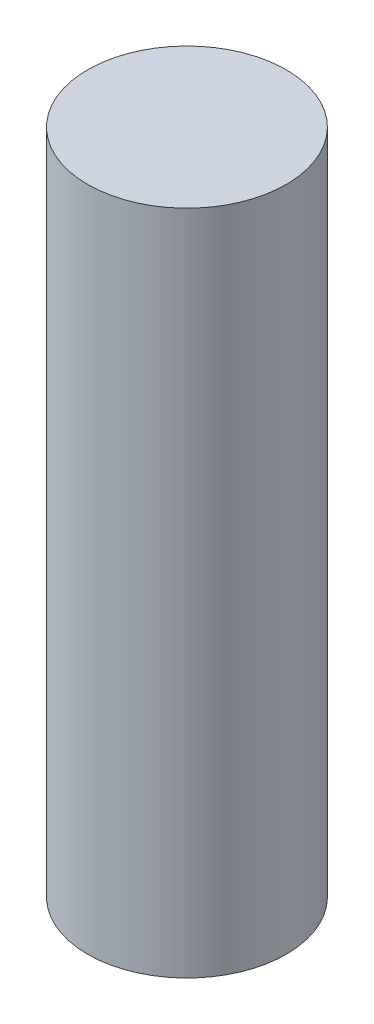
from build123d import *

# Parameters (mm, degrees)
SKETCH1_R           = 1.49
BOSS_EXTRUDE1_DEPTH = 10


with BuildPart() as part:
    # Sketch1 → Boss-Extrude1 (new body)
    with BuildSketch(Plane(origin=(0, 0, 0), x_dir=(1, 0, 0), z_dir=(0, 1, 0))):
        with Locations(Location((0, 0, 0), (0, 0, 270))):
            Circle(SKETCH1_R)
    extrude(amount=BOSS_EXTRUDE1_DEPTH)


solid = part.part
